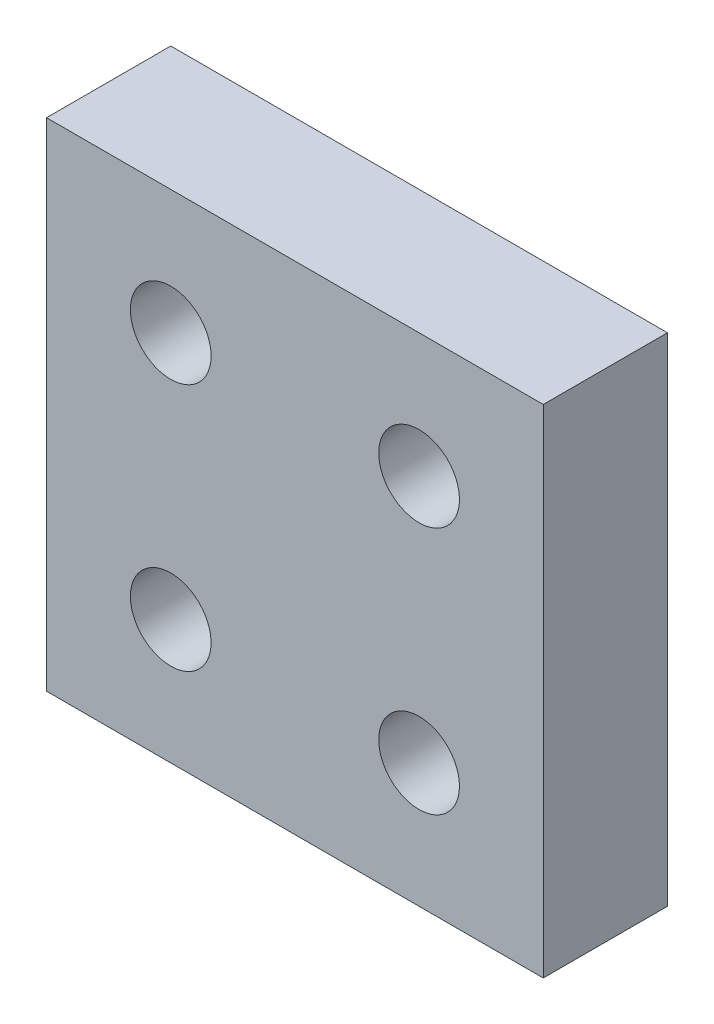
from build123d import *

# Parameters (mm, degrees)
SKETCH_1_W          = 20
SKETCH_1_H          = 20
EXTRUDE_1_DEPTH     = 5
SKETCH_2_R          = 1.625
CUT_EXTRUDE_1_DEPTH = 29.722813233


with BuildPart() as part:
    # 草图1 → 凸台-拉伸1 (new body)
    with BuildSketch(Plane.XY):
        with Locations((10, -10)):
            Rectangle(SKETCH_1_W, SKETCH_1_H)
    extrude(amount=EXTRUDE_1_DEPTH)

    # 草图2 → 切除-拉伸1 (cut, through all)
    with BuildSketch(Plane.XY.offset(5)):
        with Locations((5, -5)):
            Circle(SKETCH_2_R)
        with Locations(Location((15, -5, 0), (0, 0, 180))):
            Circle(SKETCH_2_R)
        with Locations((15, -15)):
            Circle(SKETCH_2_R)
        with Locations(Location((5, -15, 0), (0, 0, 180))):
            Circle(SKETCH_2_R)
    extrude(amount=-CUT_EXTRUDE_1_DEPTH, mode=Mode.SUBTRACT)


solid = part.part
